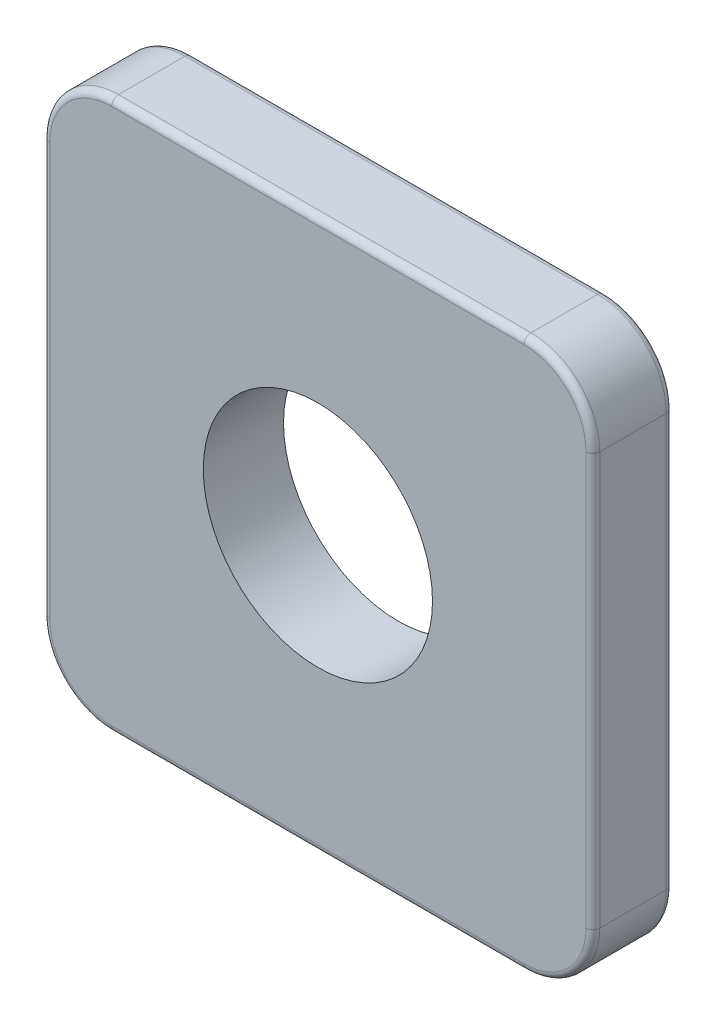
from build123d import *

# Parameters (mm, degrees)
SKETCH1_R           = 5
BOSS_EXTRUDE1_DEPTH = 1.75
FILLET1_R           = 0.3


with BuildPart() as part:
    # Sketch1 → Boss-Extrude1 (new, symmetric)
    with BuildSketch(Plane.XY):
        with BuildLine():
            Line((9, -12), (-9, -12))
            ThreePointArc((-9, -12), (-11.121320344, -11.121320344), (-12, -9))
            Line((-12, -9), (-12, 9))
            ThreePointArc((-12, 9), (-11.121320344, 11.121320344), (-9, 12))
            Line((-9, 12), (9, 12))
            ThreePointArc((9, 12), (11.121320344, 11.121320344), (12, 9))
            Line((12, 9), (12, -9))
            ThreePointArc((12, -9), (11.121320344, -11.121320344), (9, -12))
        make_face()
        Circle(SKETCH1_R, mode=Mode.SUBTRACT)
    extrude(amount=BOSS_EXTRUDE1_DEPTH, both=True)

    # Fillet1
    fillet1_edges = [part.edges().sort_by_distance(p)[0] for p in [
        (0, 12, -1.75),
        (11.121320344, 11.121320344, -1.75),
        (12, 0, -1.75),
        (11.121320344, -11.121320344, -1.75),
        (11.121320344, 11.121320344, 1.75),
        (0, 12, 1.75),
        (-11.121320344, 11.121320344, 1.75),
        (-12, 0, 1.75),
        (-11.121320344, -11.121320344, 1.75),
        (0, -12, 1.75),
        (11.121320344, -11.121320344, 1.75),
        (0, -12, -1.75),
        (12, 0, 1.75),
        (-11.121320344, -11.121320344, -1.75),
        (-12, 0, -1.75),
        (-11.121320344, 11.121320344, -1.75),
    ]]
    fillet(fillet1_edges, radius=FILLET1_R)


solid = part.part
